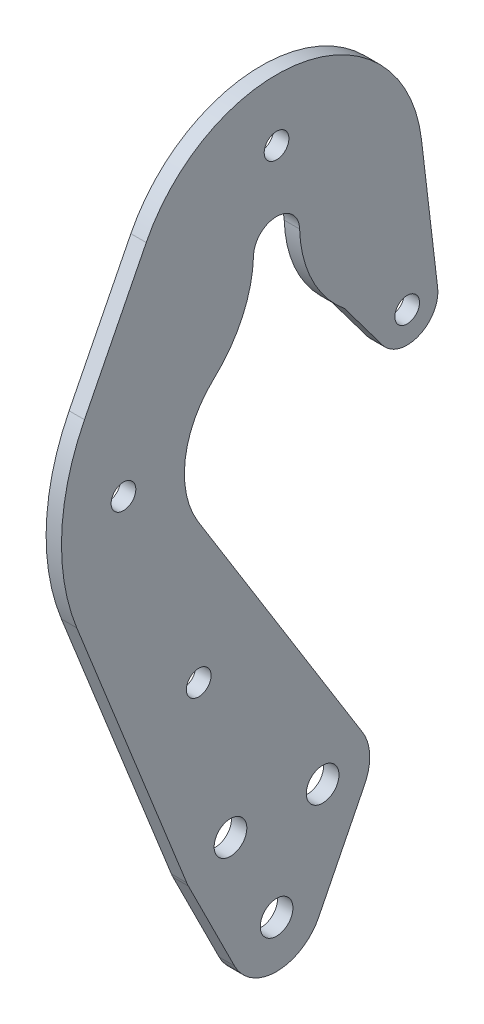
from build123d import *

# Parameters (mm, degrees)
SKETCH1_R              = 3.3782
BOSS_EXTRUDE1_DEPTH    = 3.175
F_10_CLEARANCE_HOLE1_D = 5.1054


with BuildPart() as part:
    # Sketch1 → Boss-Extrude1 (new body)
    with BuildSketch(Plane(origin=(0, 0, 0), x_dir=(0, 0, -1), z_dir=(1, 0, 0))):
        with BuildLine():
            Line((-16.180222385, 59.795006038), (17.787700231, 5.13475025))
            ThreePointArc((17.787700231, 5.13475025), (19.242822935, 0.449213357), (18.226166599, -4.3505833))
            Line((18.226166599, -4.3505833), (8.701166599, -23.4005833))
            ThreePointArc((8.701166599, -23.4005833), (0, -28.7782), (-8.701166599, -23.4005833))
            Line((-8.701166599, -23.4005833), (-18.226166599, -4.3505833))
            ThreePointArc((-18.226166599, -4.3505833), (-18.401518048, -3.980615854), (-18.561147274, -3.603597881))
            Line((-18.561147274, -3.603597881), (-41.287879188, 53.384474435))
            ThreePointArc((-41.287879188, 53.384474435), (-44.407665238, 71.789527798), (-39.695119269, 89.8525))
            Line((-39.695119269, 89.8525), (-26.935973789, 115.173125))
            ThreePointArc((-26.935973789, 115.173125), (5.234726153, 131.304781574), (29.953116968, 105.147843028))
            Line((29.953116968, 105.147843028), (33.293419362, 76.946914322))
            ThreePointArc((33.293419362, 76.946914322), (29.346967441, 70.304627798), (21.9075, 72.39))
            Line((21.9075, 72.39), (14.051055193, 82.865259743))
            ThreePointArc((14.051055193, 82.865259743), (7.358887034, 91.297415515), (4.760318612, 101.744128289))
            ThreePointArc((4.760318612, 101.744128289), (0, 106.3625), (-4.760318612, 101.744128289))
            ThreePointArc((-4.760318612, 101.744128289), (-7.038090513, 91.974290609), (-12.920864804, 83.848348214))
            ThreePointArc((-12.920864804, 83.848348214), (-18.877476959, 72.407999932), (-16.180222385, 59.795006038))
        make_face()
        with Locations((9.525, 0)):
            Circle(SKETCH1_R, mode=Mode.SUBTRACT)
        with Locations((-9.525, 0)):
            Circle(SKETCH1_R, mode=Mode.SUBTRACT)
        with Locations((0, -19.05)):
            Circle(SKETCH1_R, mode=Mode.SUBTRACT)
    extrude(amount=BOSS_EXTRUDE1_DEPTH)

    # #10 Clearance Hole1 (through all)
    with Locations(Plane(origin=(3.175, 0, 0), x_dir=(0, 0, -1), z_dir=(1, 0, 0))):
        with Locations((-16.086295304, 31.002116448), (-31.642571099, 72.098763865), (0, 119.0625), (26.9875, 76.2)):
            Hole(F_10_CLEARANCE_HOLE1_D / 2)


solid = part.part
